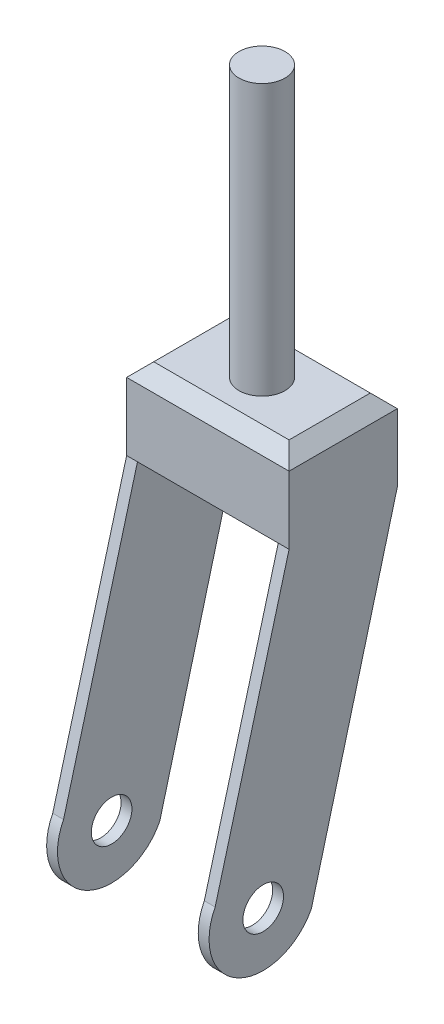
from build123d import *

# Parameters (mm, degrees)
RESSALTO_EXTRUS_O1_DEPTH      = 30
RESSALTO_EXTRUS_O1_DEPTH_BACK = 30
ESBO_O1_R                     = 7.5
ESBO_O2_W                     = 52
ESBO_O2_H                     = 143.285030211
CORTE_EXTRUS_O1_DEPTH         = 123.474851541
CHANFRO1_SIZE                 = 5
ESBO_O3_R                     = 8.5
RESSALTO_EXTRUS_O2_DEPTH      = 100


with BuildPart() as part:
    # Esboço1 → Ressalto-extrusão1 (new, two sides: drawn at the far end of the back side and taken through both)
    with BuildSketch(Plane(origin=(0, 0, 0), x_dir=(0, 0, -1), z_dir=(1, 0, 0)).offset(-RESSALTO_EXTRUS_O1_DEPTH_BACK)):
        with BuildLine():
            Line((17.662425064, 66.241666463), (17.662425064, 96.241666463))
            Line((17.662425064, 96.241666463), (57.662425064, 96.241666463))
            Line((57.662425064, 96.241666463), (57.662425064, 66.241666463))
            Line((57.662425064, 66.241666463), (25.862440111, -52.968524997))
            ThreePointArc((25.862440111, -52.968524997), (-1.100846101, -61.511428289), (-9.643749393, -34.548142078))
            Line((-9.643749393, -34.548142078), (17.662425064, 66.241666463))
        make_face()
        with Locations((8.109345359, -43.758333537)):
            Circle(ESBO_O1_R, mode=Mode.SUBTRACT)
    extrude(amount=RESSALTO_EXTRUS_O1_DEPTH + RESSALTO_EXTRUS_O1_DEPTH_BACK)

    # Esboço2 → Corte-extrusão1 (cut, through all)
    with BuildSketch(Plane(origin=(0, 0, -57.662425064), x_dir=(-1, 0, 0), z_dir=(0, 0, -1))):
        with Locations((0, -5.400848643)):
            Rectangle(ESBO_O2_W, ESBO_O2_H)
    extrude(amount=-CORTE_EXTRUS_O1_DEPTH, mode=Mode.SUBTRACT)

    # Chanfro1
    chanfro1_edges = [part.edges().sort_by_distance(p)[0] for p in [
        (0, 96.241666463, -17.662425064),
        (-30, 96.241666463, -37.662425064),
        (30, 96.241666463, -37.662425064),
        (0, 96.241666463, -57.662425064),
    ]]
    chamfer(chanfro1_edges, length=CHANFRO1_SIZE)

    # Esboço3 → Ressalto-extrusão2 (add)
    with BuildSketch(Plane(origin=(0, 96.241666463, 0), x_dir=(1, 0, 0), z_dir=(0, 1, 0))):
        with Locations((0, 37.662425064)):
            Circle(ESBO_O3_R)
    extrude(amount=RESSALTO_EXTRUS_O2_DEPTH)


solid = part.part
